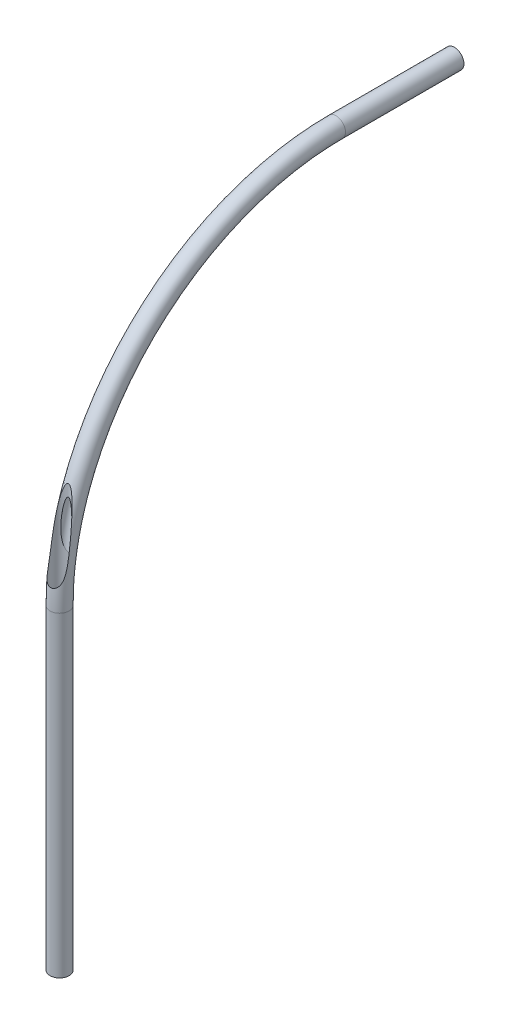
from build123d import *

# Parameters (mm, degrees)
IZIM2_R               = 2.425
BO_ALTMA1_T           = -1
IZIM3_R               = 2.25
KES_EKSTR_ZYON1_DEPTH = 109


with BuildPart() as part:
    # Süpür1: sweep along a path in Çizim1
    with BuildLine(Plane(origin=(0, 0, 0), x_dir=(0, 0, -1), z_dir=(1, 0, 0))) as s_p_r1_path:
        Line((0, 350), (0, 430))
        ThreePointArc((0, 430), (20.502525317, 479.497474683), (70, 500))
        Line((70, 500), (100, 500))
    # Çizim2 → Süpür1 (sweep)
    with BuildSketch(Plane(origin=(0, 500, -100), x_dir=(-1, 0, 0), z_dir=(0, 0, -1))):
        Circle(IZIM2_R)
    sweep(path=s_p_r1_path.line)

    # İç Boşaltma1
    bo_altma1_openings = [part.faces().sort_by_distance(p)[0] for p in [
        (0, 500, -100),
    ]]
    offset(amount=BO_ALTMA1_T, openings=bo_altma1_openings, kind=Kind.INTERSECTION)

    # Çizim3 → Kes-Ekstrüzyon1 (cut)
    with BuildSketch(Plane.XZ.offset(-350)):
        with Locations(Location((0, 0, 0), (0, 0, 270))):
            Circle(IZIM3_R)
    extrude(amount=-KES_EKSTR_ZYON1_DEPTH, mode=Mode.SUBTRACT)


solid = part.part
